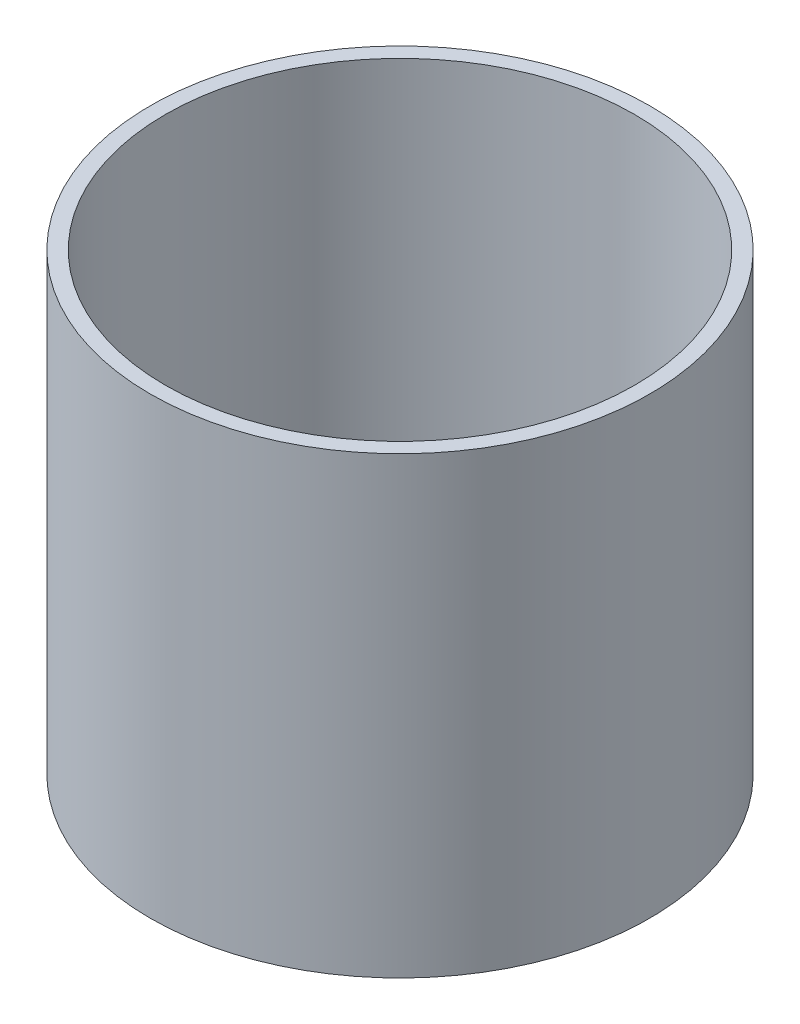
from build123d import *

# Parameters (mm, degrees)
SKETCH1_R           = 33
SKETCH1_R_2         = 31
BOSS_EXTRUDE1_DEPTH = 60


with BuildPart() as part:
    # Sketch1 → Boss-Extrude1 (new body)
    with BuildSketch(Plane(origin=(0, 0, 0), x_dir=(1, 0, 0), z_dir=(0, 1, 0))):
        with Locations(Location((0, 0, 0), (0, 0, 270))):
            Circle(SKETCH1_R)
        with Locations(Location((0, 0, 0), (0, 0, 270))):
            Circle(SKETCH1_R_2, mode=Mode.SUBTRACT)
    extrude(amount=BOSS_EXTRUDE1_DEPTH)


solid = part.part
